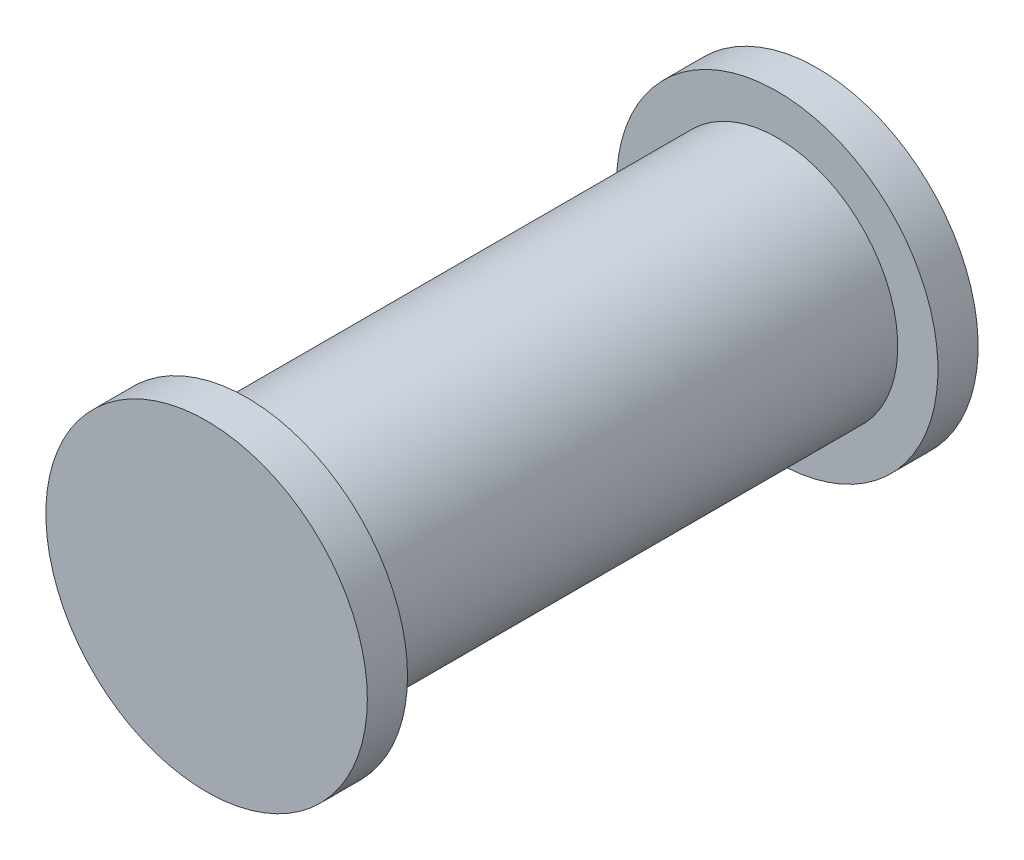
from build123d import *

# Parameters (mm, degrees)
SKETCH_1_R      = 30
EXTRUDE_1_DEPTH = 132
SKETCH_2_R      = 40
EXTRUDE_2_DEPTH = 10
EXTRUDE_START   = 10
SKETCH_3_R      = 40
EXTRUDE_3_DEPTH = 10
SCALE_1_SCALE   = 0.345


with BuildPart() as part:
    # 草图1 → 凸台-拉伸1 (new body)
    with BuildSketch(Plane.XY):
        Circle(SKETCH_1_R)
    extrude(amount=EXTRUDE_1_DEPTH)

    # 草图2 → 凸台-拉伸2 (add)
    with BuildSketch(Plane.XY.offset(132)):
        Circle(SKETCH_2_R)
    extrude(amount=EXTRUDE_2_DEPTH)

    # 草图3 → 凸台-拉伸3 (add)
    with BuildSketch(Plane(origin=(0, 0, 0), x_dir=(-1, 0, 0), z_dir=(0, 0, -1)).offset(EXTRUDE_START)):
        with Locations(Location((0, 0, 0), (0, 0, 180))):
            Circle(SKETCH_3_R)
    extrude(amount=-EXTRUDE_3_DEPTH)


with BuildPart() as part_1:
    # 缩放比例1: scaled about (0, 0, 0)
    add(part.part.scale(SCALE_1_SCALE))


solid = part_1.part
